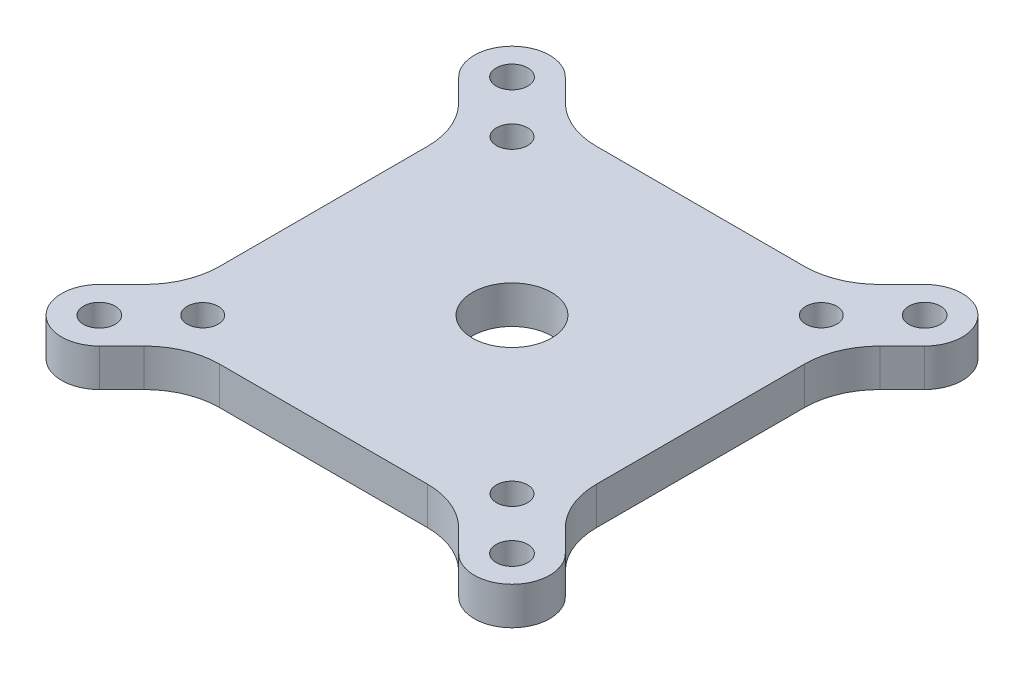
from build123d import *

# Parameters (mm, degrees)
SKETCH1_W           = 85.2
SKETCH1_H           = 85.2
BOSS_EXTRUDE1_DEPTH = 6.35
CUT_EXTRUDE1_REACH  = 62.579
SKETCH2_R           = 6.6675
CUT_EXTRUDE2_REACH  = 62.579
SKETCH3_R           = 2.6162
CUT_EXTRUDE3_REACH  = 62.579
SKETCH5_R           = 2.665
CIRPATTERN1_COUNT   = 4
CUT_EXTRUDE4_REACH  = 62.579
SKETCH6_W           = 85.2
SKETCH6_H           = 85.2
FILLET1_R           = 12.7


with BuildPart() as part:
    # Sketch1 → Boss-Extrude1 (new body)
    with BuildSketch(Plane(origin=(0, 0, 0), x_dir=(1, 0, 0), z_dir=(0, 1, 0))):
        Rectangle(SKETCH1_W, SKETCH1_H)
    extrude(amount=BOSS_EXTRUDE1_DEPTH)

    # Sketch2 → Cut-Extrude1 (cut, up to next)
    with BuildSketch(Plane(origin=(0, 6.35, 0), x_dir=(1, 0, 0), z_dir=(0, 1, 0)), mode=Mode.PRIVATE) as cut_extrude1_sk1:
        with Locations(Location((0, 0, 0), (0, 0, 270))):
            Circle(SKETCH2_R)
    cut_extrude1_tool1 = extrude(cut_extrude1_sk1.sketch, amount=-CUT_EXTRUDE1_REACH, mode=Mode.PRIVATE) & part.part
    add(cut_extrude1_tool1.solids().sort_by_distance((0, 6.35, 0))[0], mode=Mode.SUBTRACT)

    # Sketch3 → Cut-Extrude2 (cut, up to next)
    with BuildSketch(Plane(origin=(0, 6.35, 0), x_dir=(1, 0, 0), z_dir=(0, 1, 0)), mode=Mode.PRIVATE) as cut_extrude2_sk1:
        with Locations(Location((26.042742751, -26.042742751, 0), (0, 0, 270))):
            Circle(SKETCH3_R)
    cut_extrude2_tool1 = extrude(cut_extrude2_sk1.sketch, amount=-CUT_EXTRUDE2_REACH, mode=Mode.PRIVATE) & part.part
    # Sketch3 → Cut-Extrude2 (cut, up to next)
    with BuildSketch(Plane(origin=(0, 6.35, 0), x_dir=(1, 0, 0), z_dir=(0, 1, 0)), mode=Mode.PRIVATE) as cut_extrude2_sk2:
        with Locations(Location((-26.042742751, -26.042742751, 0), (0, 0, 270))):
            Circle(SKETCH3_R)
    cut_extrude2_tool2 = extrude(cut_extrude2_sk2.sketch, amount=-CUT_EXTRUDE2_REACH, mode=Mode.PRIVATE) & part.part
    # Sketch3 → Cut-Extrude2 (cut, up to next)
    with BuildSketch(Plane(origin=(0, 6.35, 0), x_dir=(1, 0, 0), z_dir=(0, 1, 0)), mode=Mode.PRIVATE) as cut_extrude2_sk3:
        with Locations(Location((26.042742751, 26.042742751, 0), (0, 0, 90))):
            Circle(SKETCH3_R)
    cut_extrude2_tool3 = extrude(cut_extrude2_sk3.sketch, amount=-CUT_EXTRUDE2_REACH, mode=Mode.PRIVATE) & part.part
    # Sketch3 → Cut-Extrude2 (cut, up to next)
    with BuildSketch(Plane(origin=(0, 6.35, 0), x_dir=(1, 0, 0), z_dir=(0, 1, 0)), mode=Mode.PRIVATE) as cut_extrude2_sk4:
        with Locations(Location((-26.042742751, 26.042742751, 0), (0, 0, 90))):
            Circle(SKETCH3_R)
    cut_extrude2_tool4 = extrude(cut_extrude2_sk4.sketch, amount=-CUT_EXTRUDE2_REACH, mode=Mode.PRIVATE) & part.part
    add(cut_extrude2_tool1.solids().sort_by_distance((26.042743, 6.35, 26.042743))[0], mode=Mode.SUBTRACT)
    add(cut_extrude2_tool2.solids().sort_by_distance((-26.042743, 6.35, 26.042743))[0], mode=Mode.SUBTRACT)
    add(cut_extrude2_tool3.solids().sort_by_distance((26.042743, 6.35, -26.042743))[0], mode=Mode.SUBTRACT)
    add(cut_extrude2_tool4.solids().sort_by_distance((-26.042743, 6.35, -26.042743))[0], mode=Mode.SUBTRACT)

    # Sketch5 → Cut-Extrude3 (cut, up to next)
    with BuildSketch(Plane(origin=(0, 6.35, 0), x_dir=(1, 0, 0), z_dir=(0, 1, 0)), mode=Mode.PRIVATE) as cut_extrude3_sk1:
        with Locations(Location((-34.75, -34.75, 0), (0, 0, 270))):
            Circle(SKETCH5_R)
    cut_extrude3_tool1 = extrude(cut_extrude3_sk1.sketch, amount=-CUT_EXTRUDE3_REACH, mode=Mode.PRIVATE) & part.part
    cut_extrude3 = cut_extrude3_tool1.solids().sort_by_distance((-34.75, 6.35, 34.75))[0]
    add(cut_extrude3, mode=Mode.SUBTRACT)

    # CirPattern1: Cut-Extrude3 ×4 about axis
    cirpattern1_axis = Axis((0, 0, 0), (0, 1, 0))
    for i in range(1, CIRPATTERN1_COUNT):
        add(cut_extrude3.rotate(cirpattern1_axis, i * 360 / CIRPATTERN1_COUNT), mode=Mode.SUBTRACT)

    # Sketch6 → Cut-Extrude4 (cut, up to next)
    with BuildSketch(Plane(origin=(0, 6.35, 0), x_dir=(1, 0, 0), z_dir=(0, 1, 0)), mode=Mode.PRIVATE) as cut_extrude4_sk1:
        Rectangle(SKETCH6_W, SKETCH6_H)
        with BuildLine():
            Line((31.75, -22.769743879), (39.240128061, -30.259871939))
            ThreePointArc((39.240128061, -30.259871939), (40.616635031, -32.319960204), (41.1, -34.75))
            ThreePointArc((41.1, -34.75), (37.180039796, -40.616635031), (30.259871939, -39.240128061))
            Line((30.259871939, -39.240128061), (22.769743879, -31.75))
            Line((22.769743879, -31.75), (-22.769743879, -31.75))
            Line((-22.769743879, -31.75), (-30.259871939, -39.240128061))
            ThreePointArc((-30.259871939, -39.240128061), (-39.240128061, -39.240128061), (-39.240128061, -30.259871939))
            Line((-39.240128061, -30.259871939), (-31.75, -22.769743879))
            Line((-31.75, -22.769743879), (-31.75, 22.769743879))
            Line((-31.75, 22.769743879), (-39.240128061, 30.259871939))
            ThreePointArc((-39.240128061, 30.259871939), (-39.240128061, 39.240128061), (-30.259871939, 39.240128061))
            Line((-30.259871939, 39.240128061), (-22.769743879, 31.75))
            Line((-22.769743879, 31.75), (22.769743879, 31.75))
            Line((22.769743879, 31.75), (30.259871939, 39.240128061))
            ThreePointArc((30.259871939, 39.240128061), (37.180039796, 40.616635031), (41.1, 34.75))
            ThreePointArc((41.1, 34.75), (40.616635031, 32.319960204), (39.240128061, 30.259871939))
            Line((39.240128061, 30.259871939), (31.75, 22.769743879))
            Line((31.75, 22.769743879), (31.75, -22.769743879))
        make_face(mode=Mode.SUBTRACT)
    cut_extrude4_tool1 = extrude(cut_extrude4_sk1.sketch, amount=-CUT_EXTRUDE4_REACH, mode=Mode.PRIVATE) & part.part
    add(cut_extrude4_tool1.solids().sort_by_distance((0, 6.35, 41.39509))[0], mode=Mode.SUBTRACT)

    # Fillet1
    fillet1_edges = [part.edges().sort_by_distance(p)[0] for p in [
        (22.769743879, 3.175, -31.75),
        (-22.769743879, 3.175, -31.75),
        (-31.75, 3.175, -22.769743879),
        (-31.75, 3.175, 22.769743879),
        (-22.769743879, 3.175, 31.75),
        (22.769743879, 3.175, 31.75),
        (31.75, 3.175, 22.769743879),
        (31.75, 3.175, -22.769743879),
    ]]
    fillet(fillet1_edges, radius=FILLET1_R)


solid = part.part
